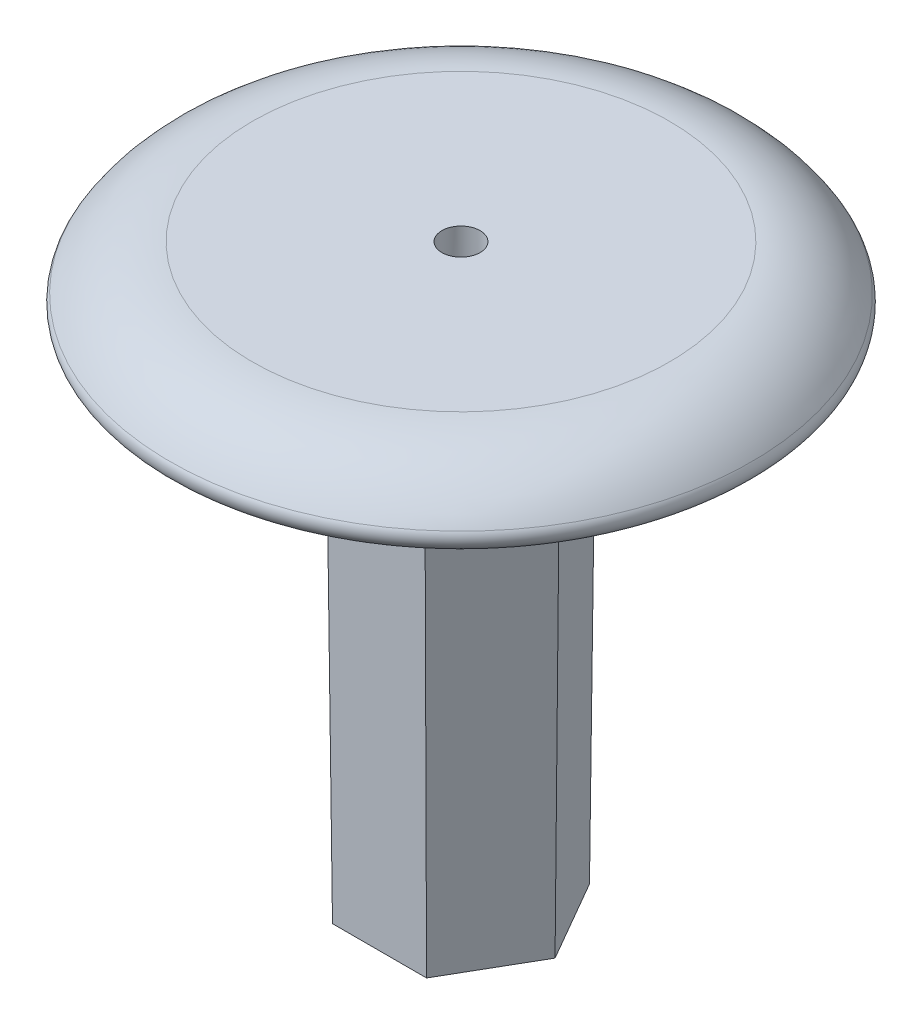
from build123d import *

# Parameters (mm, degrees)
SHAFT_DEPTH          = 22.352
DRAFT_ON_SHAFT_ANGLE = 0.5
SKETCH3_R            = 1.524
THRU_HOLE_DEPTH      = 28.574862156
THRU_HOLE_DRAFT      = -2
FILLET1_R            = 1.27


with BuildPart() as part:
    # Sketch1 → Head (revolve)
    with BuildSketch(Plane.XY):
        with BuildLine():
            Line((0, 0), (10.910430592, 0))
            ThreePointArc((10.910430592, 0), (11.355976066, 0.263964694), (11.338496837, 0.781538462))
            ThreePointArc((11.338496837, 0.781538462), (9.958264798, 2.071591054), (8.128, 2.54))
            Line((8.128, 2.54), (0, 2.54))
            Line((0, 2.54), (0, 0))
        make_face()
    revolve(axis=Axis((0, 2.54, 0), (0, -1, 0)))

    # Sketch2 → Shaft (add)
    with BuildSketch(Plane(origin=(0, 2.54, 0), x_dir=(-1, 0, 0), z_dir=(0, 1, 0))):
        Polygon((1.833087105, -3.175), (-1.833087105, -3.175), (-3.666174209, 0), (-1.833087105, 3.175), (1.833087105, 3.175), (3.666174209, 0), align=None)
    extrude(amount=-SHAFT_DEPTH)

    # Draft on Shaft
    draft_on_shaft_faces = [part.faces().sort_by_distance(p)[0] for p in [
        (0, -9.906, 3.175),
        (2.749630657, -9.906, 1.5875),
        (2.749630657, -9.906, -1.5875),
        (0, -9.906, -3.175),
        (-2.749630657, -9.906, -1.5875),
        (-2.749630657, -9.906, 1.5875),
    ]]
    draft(draft_on_shaft_faces, Plane(origin=(5.499261314, -19.812, 3.175), x_dir=(-1, 0, 0), z_dir=(0, -1, 0)), DRAFT_ON_SHAFT_ANGLE)


with BuildPart() as thru_hole_tool:
    # Sketch3 → Thru Hole (with draft: the straight prism first)
    with BuildSketch(Plane.XZ.offset(19.812)):
        Circle(SKETCH3_R)
    extrude(amount=-THRU_HOLE_DEPTH)
    # Thru Hole: the draft: its side faces are tilted about the plane it starts from
    thru_hole_sides = [thru_hole_tool.faces().sort_by_distance(p)[0] for p in [
        (-1.524, -5.524568922, 0),
    ]]
    draft(thru_hole_sides, Plane.XZ.offset(19.812), THRU_HOLE_DRAFT)


with BuildPart() as part_1:
    add(part.part)

    # Thru Hole: cut by thru_hole_tool
    add(thru_hole_tool.part, mode=Mode.SUBTRACT)

    # Fillet1
    fillet1_edges = [part_1.edges().sort_by_distance(p)[0] for p in [
        (0, 0, -3.347896705),
        (-2.899363595, 0, -1.673948352),
        (-2.899363595, 0, 1.673948352),
        (0, 0, 3.347896705),
        (2.899363595, 0, 1.673948352),
        (2.899363595, 0, -1.673948352),
    ]]
    fillet(fillet1_edges, radius=FILLET1_R)


solid = part_1.part
